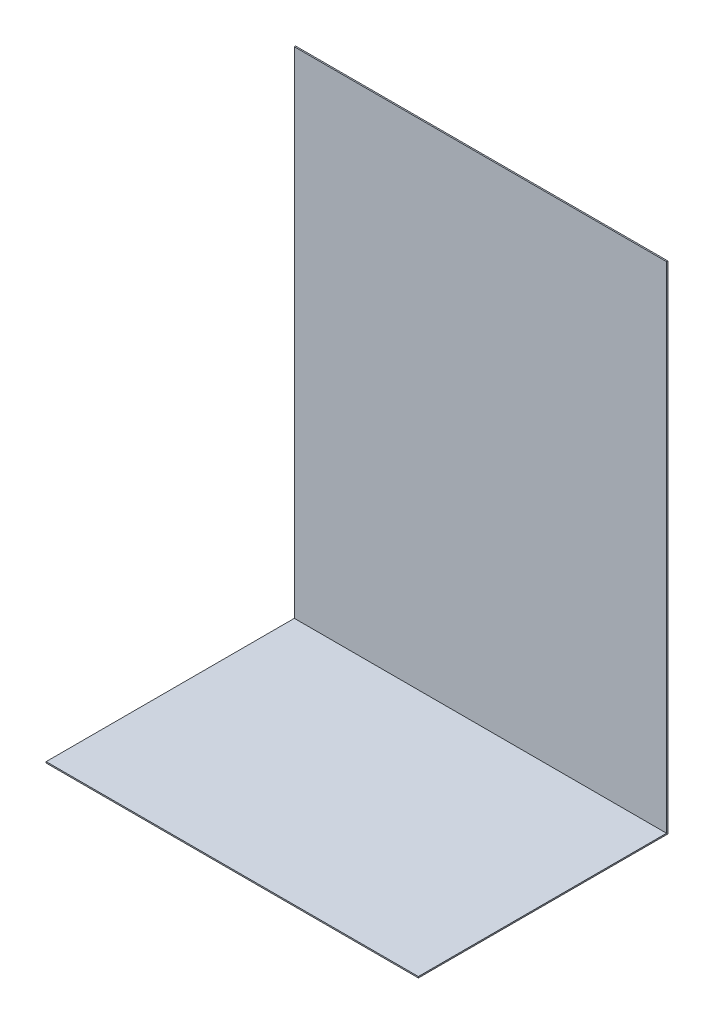
from build123d import *

# Parameters (mm, degrees)
SKETCH1_W           = 1828.8
SKETCH1_H           = 2438.4
BOSS_EXTRUDE1_DEPTH = 6.35
SKETCH2_W           = 1828.8
SKETCH2_H           = 6.35
BOSS_EXTRUDE2_DEPTH = 1219.2


with BuildPart() as part:
    # Sketch1 → Boss-Extrude1 (new body)
    with BuildSketch(Plane.XY):
        Rectangle(SKETCH1_W, SKETCH1_H)
    extrude(amount=BOSS_EXTRUDE1_DEPTH)

    # Sketch2 → Boss-Extrude2 (add)
    with BuildSketch(Plane.XY.offset(6.35)):
        with Locations((0, -1216.025)):
            Rectangle(SKETCH2_W, SKETCH2_H)
    extrude(amount=BOSS_EXTRUDE2_DEPTH)


solid = part.part
